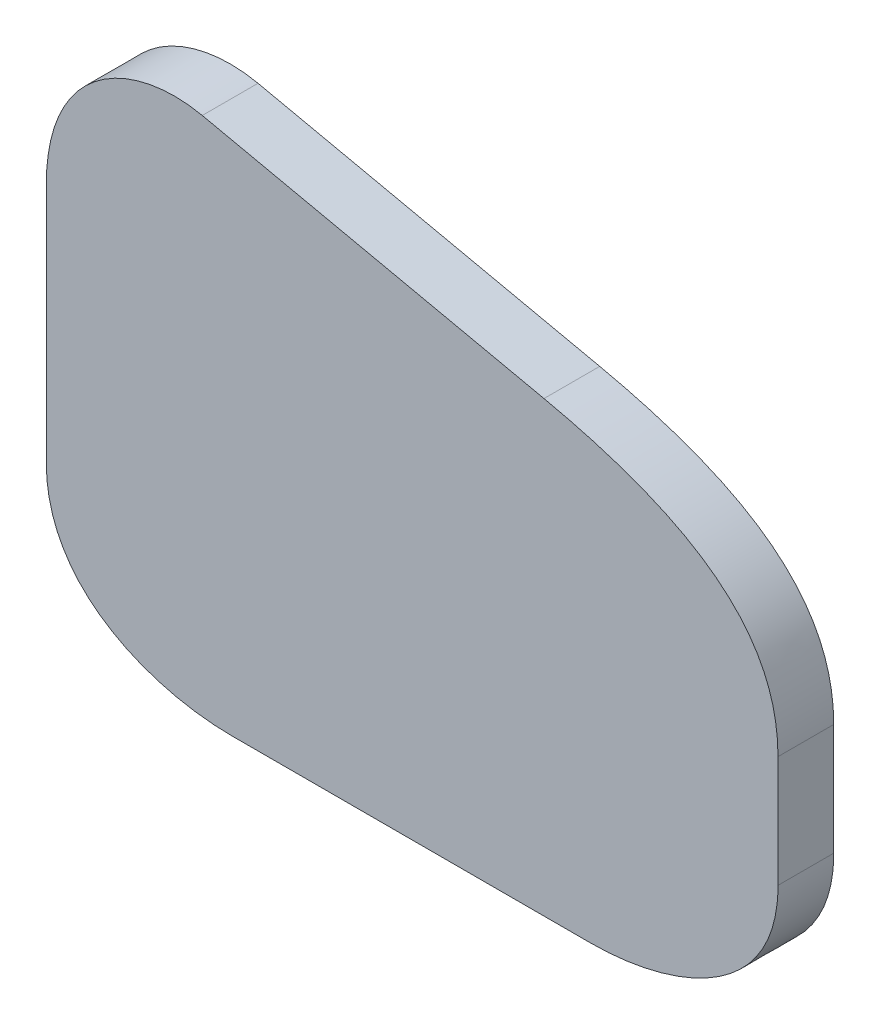
from build123d import *

# Parameters (mm, degrees)
EXTRUDE_1_DEPTH = 10


with BuildPart() as part:
    # Эскиз1_fr → Бобышка-Вытянуть1 (new body)
    with BuildSketch(Plane.XY):
        with BuildLine():
            Line((0, 0), (0, 20))
            add(Edge.make_bspline(
                [(0, 20), (0, 38.146025899), (-14.209474182, 48.611098897), (-41.986949672, 54.649680525)],
                knots=[0, 0, 0, 0, 1, 1, 1, 1], degree=3))
            Line((-41.986949672, 54.649680525), (-103.301225383, 67.978870897))
            add(Edge.make_bspline(
                [(-103.301225383, 67.978870897), (-115.500001367, 70.63077872), (-131.292525164, 63.393306184), (-131.292525164, 43.097715536)],
                knots=[0, 0, 0, 0, 1, 1, 1, 1], degree=3))
            Line((-131.292525164, 43.097715536), (-131.292525164, 0))
            add(Edge.make_bspline(
                [(-97.969549234, -25.769768053), (-112.011160689, -25.769768053), (-131.292525164, -19.025155818), (-131.292525164, 0)],
                knots=[0, 0, 0, 0, 1, 1, 1, 1], degree=3))
            Line((-97.969549234, -25.769768053), (-33.545129103, -25.769768053))
            add(Edge.make_bspline(
                [(-33.545129103, -25.769768053), (-19.444866568, -25.769768053), (0, -19.063757455), (0, 0)],
                knots=[0, 0, 0, 0, 1, 1, 1, 1], degree=3))
        make_face()
    extrude(amount=EXTRUDE_1_DEPTH)


solid = part.part
